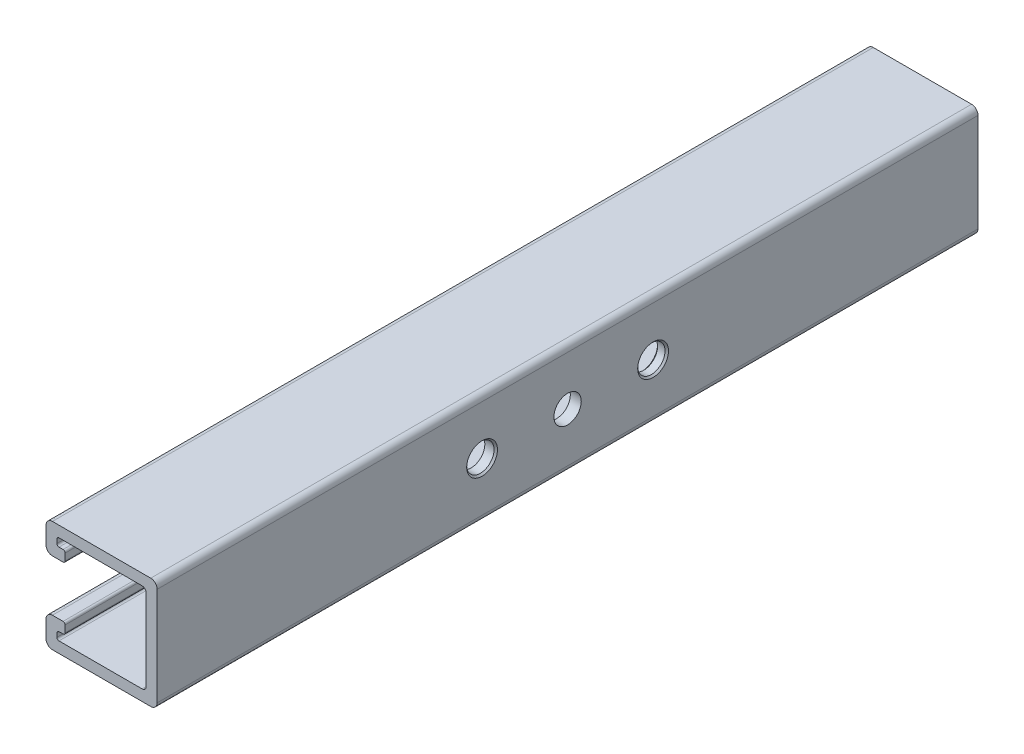
from build123d import *

# Parameters (mm, degrees)
EXTRUDE_THIN1_DEPTH = 304.8
FILLET2_R           = 0.762
FILLET3_R           = 1.524
SKETCH4_R           = 5.08
CUT_EXTRUDE1_DEPTH  = 309.273534432
CHAMFER1_SIZE       = 0.635


with BuildPart() as part:
    # Sketch1 → Extrude-Thin1 (new body)
    with BuildSketch(Plane.XY):
        with BuildLine():
            Line((-13.5255, 9.525), (-18.2499, 9.525))
            ThreePointArc((-18.2499, 9.525), (-19.938188151, 10.224311849), (-20.6375, 11.9126))
            Line((-20.6375, 11.9126), (-20.6375, 18.2499))
            ThreePointArc((-20.6375, 18.2499), (-19.938188151, 19.938188151), (-18.2499, 20.6375))
            Line((-18.2499, 20.6375), (18.2499, 20.6375))
            ThreePointArc((18.2499, 20.6375), (19.938188151, 19.938188151), (20.6375, 18.2499))
            Line((20.6375, 18.2499), (20.6375, -18.2499))
            ThreePointArc((20.6375, -18.2499), (19.938188151, -19.938188151), (18.2499, -20.6375))
            Line((18.2499, -20.6375), (-18.2499, -20.6375))
            ThreePointArc((-18.2499, -20.6375), (-19.938188151, -19.938188151), (-20.6375, -18.2499))
            Line((-20.6375, -18.2499), (-20.6375, -11.9126))
            ThreePointArc((-20.6375, -11.9126), (-19.938188151, -10.224311849), (-18.2499, -9.525))
            Line((-18.2499, -9.525), (-13.5255, -9.525))
            Line((-13.5255, -9.525), (-13.5255, -13.589))
            Line((-13.5255, -13.589), (-16.5735, -13.589))
            Line((-16.5735, -13.589), (-16.5735, -16.5735))
            Line((-16.5735, -16.5735), (16.5735, -16.5735))
            Line((16.5735, -16.5735), (16.5735, 16.5735))
            Line((16.5735, 16.5735), (-16.5735, 16.5735))
            Line((-16.5735, 16.5735), (-16.5735, 13.589))
            Line((-16.5735, 13.589), (-13.5255, 13.589))
            Line((-13.5255, 13.589), (-13.5255, 9.525))
        make_face()
    extrude(amount=-EXTRUDE_THIN1_DEPTH)

    # Fillet2
    fillet2_edges = [part.edges().sort_by_distance(p)[0] for p in [
        (-16.5735, -13.589, -152.4),
        (-16.5735, -16.5735, -152.4),
        (-16.5735, 16.5735, -152.4),
        (-16.5735, 13.589, -152.4),
        (-13.5255, 13.589, -152.4),
        (-13.5255, 9.525, -152.4),
        (-13.5255, -9.525, -152.4),
        (-13.5255, -13.589, -152.4),
    ]]
    fillet(fillet2_edges, radius=FILLET2_R)

    # Fillet3
    fillet3_edges = [part.edges().sort_by_distance(p)[0] for p in [
        (16.5735, -16.5735, -152.4),
        (16.5735, 16.5735, -152.4),
    ]]
    fillet(fillet3_edges, radius=FILLET3_R)

    # Sketch4 → Cut-Extrude1 (cut, through all)
    with BuildSketch(Plane(origin=(20.6375, 0, 0), x_dir=(0, 0, -1), z_dir=(1, 0, 0))):
        with Locations((152.4, 0)):
            Circle(SKETCH4_R)
        with Locations((184.15, 0)):
            Circle(SKETCH4_R)
        with Locations((120.65, 0)):
            Circle(SKETCH4_R)
    extrude(amount=-CUT_EXTRUDE1_DEPTH, mode=Mode.SUBTRACT)

    # Chamfer1
    chamfer1_edges = [part.edges().sort_by_distance(p)[0] for p in [
        (20.6375, 0, -115.57),
        (16.5735, 0, -179.07),
        (20.6375, 0, -179.07),
    ]]
    chamfer(chamfer1_edges, length=CHAMFER1_SIZE)


solid = part.part
